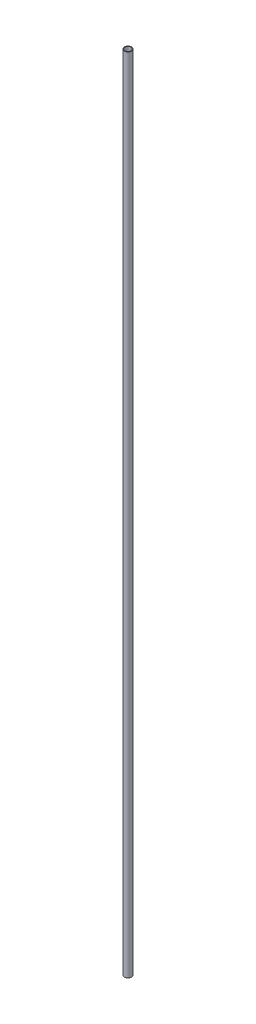
from build123d import *

# Parameters (mm, degrees)
SKETCH1_R           = 6.35
SKETCH1_R_2         = 5.35
BOSS_EXTRUDE1_DEPTH = 1399.5


with BuildPart() as part:
    # Sketch1 → Boss-Extrude1 (new body)
    with BuildSketch(Plane(origin=(0, 0, 0), x_dir=(1, 0, 0), z_dir=(0, 1, 0))):
        with Locations(Location((0, 0, 0), (0, 0, 270))):
            Circle(SKETCH1_R)
        with Locations(Location((0, 0, 0), (0, 0, 270))):
            Circle(SKETCH1_R_2, mode=Mode.SUBTRACT)
    extrude(amount=BOSS_EXTRUDE1_DEPTH)


solid = part.part
